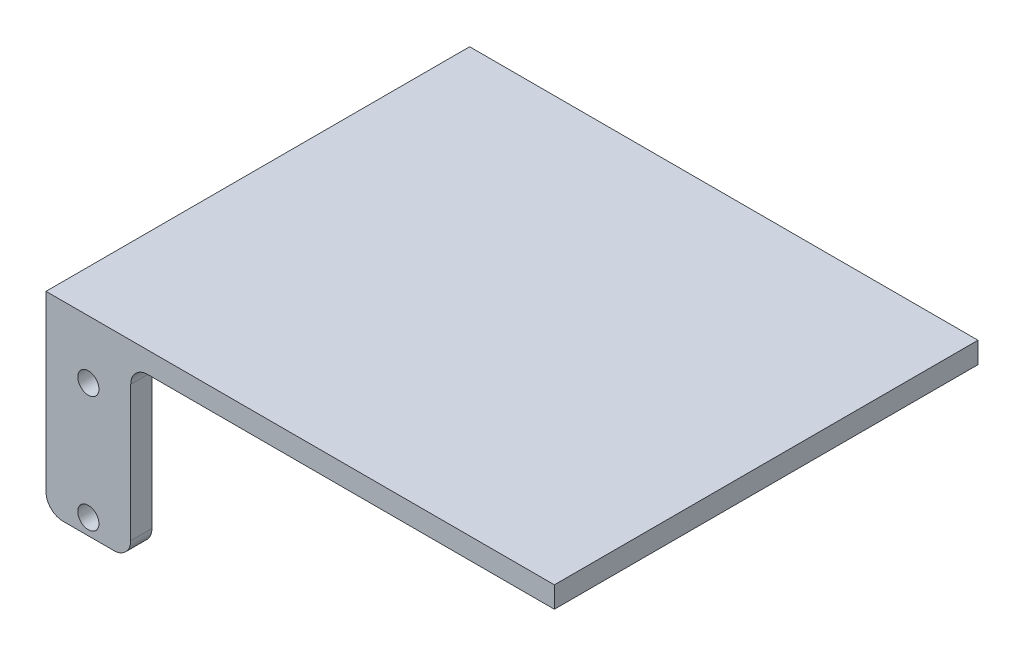
from build123d import *

# Parameters (mm, degrees)
SKETCH1_W           = 76.2
SKETCH1_H           = 63.5
BOSS_EXTRUDE1_DEPTH = 3.175
SKETCH3_W           = 12.7
SKETCH3_H           = 25.4
SKETCH3_R           = 1.5875
BOSS_EXTRUDE2_DEPTH = 3.175
FILLET1_R           = 2.54


with BuildPart() as part:
    # Sketch1 → Boss-Extrude1 (new body)
    with BuildSketch(Plane(origin=(0, 0, 0), x_dir=(1, 0, 0), z_dir=(0, 1, 0))):
        Rectangle(SKETCH1_W, SKETCH1_H)
    extrude(amount=-BOSS_EXTRUDE1_DEPTH)

    # Sketch3 → Boss-Extrude2 (add)
    with BuildSketch(Plane.XY.offset(31.75)):
        with Locations((-31.75, -15.875)):
            Rectangle(SKETCH3_W, SKETCH3_H)
        with Locations((-31.75, -26.19375)):
            Circle(SKETCH3_R, mode=Mode.SUBTRACT)
        with Locations((-31.75, -8.73125)):
            Circle(SKETCH3_R, mode=Mode.SUBTRACT)
    boss_extrude2 = extrude(amount=-BOSS_EXTRUDE2_DEPTH)

    # Mirror1: Boss-Extrude2 across plane
    add(boss_extrude2.mirror(Plane.XY))

    # Fillet1
    fillet1_edges = [part.edges().sort_by_distance(p)[0] for p in [
        (-38.1, -28.575, 30.1625),
        (-25.4, -3.175, 30.1625),
        (-25.4, -28.575, 30.1625),
        (-38.1, -28.575, -30.1625),
        (-25.4, -28.575, -30.1625),
        (-25.4, -3.175, -30.1625),
    ]]
    fillet(fillet1_edges, radius=FILLET1_R)


solid = part.part
